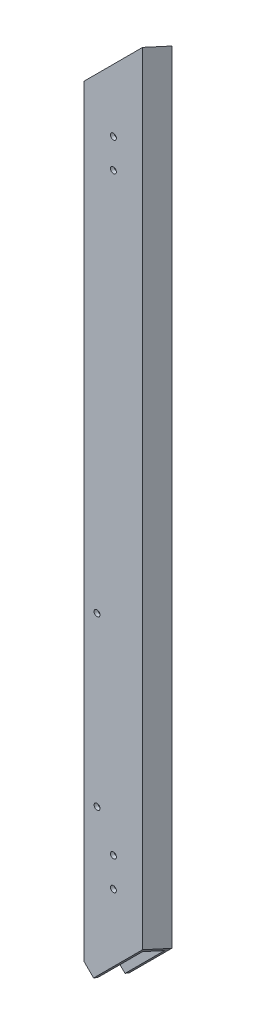
from build123d import *

# Parameters (mm, degrees)
SKETCH1_W                        = 50.8
SKETCH1_H                        = 25.4
SKETCH1_W_2                      = 44.45
SKETCH1_H_2                      = 19.05
BOSS_EXTRUDE1_DEPTH              = 728.3704
CUT_EXTRUDE1_DEPTH               = 730.255620202
CUT_EXTRUDE2_DEPTH               = 552.395616702
CUT_EXTRUDE3_DEPTH               = 735.841052167
F_13_64_0_20313_DIAMETER_HOLE1_D = 5.159502
F_13_64_0_20313_DIAMETER_HOLE2_D = 5.159502


with BuildPart() as part:
    # Sketch1 → Boss-Extrude1 (new body)
    with BuildSketch(Plane(origin=(0, 0, 0), x_dir=(1, 0, 0), z_dir=(0, 1, 0))):
        Rectangle(SKETCH1_W, SKETCH1_H)
        Rectangle(SKETCH1_W_2, SKETCH1_H_2, mode=Mode.SUBTRACT)
    extrude(amount=BOSS_EXTRUDE1_DEPTH)

    # Sketch2 → Cut-Extrude1 (cut, through all)
    with BuildSketch(Plane.XY.offset(12.7)):
        Polygon((-25.4, 677.5704), (25.4, 728.3704), (-25.4, 728.3704), align=None)
        Polygon((-11.4046, 0), (-25.4, 13.9954), (-25.4, 0), align=None)
        Polygon((-11.4046, 0), (25.4, 36.8046), (25.4, 0), align=None)
    extrude(amount=-CUT_EXTRUDE1_DEPTH, mode=Mode.SUBTRACT)

    # Sketch3 → Cut-Extrude2 (cut, through all)
    with BuildSketch(Plane(origin=(376.8852, 376.8852, 0), x_dir=(0, 0, -1), z_dir=(0.7071067811865417, 0.7071067811865535, 0))):
        Polygon((-12.7, 497.075136813), (12.7, 488.822176529), (12.7, 497.075136813), align=None)
    extrude(amount=-CUT_EXTRUDE2_DEPTH, mode=Mode.SUBTRACT)

    # Sketch4 → Cut-Extrude3 (cut, through all)
    with BuildSketch(Plane(origin=(-5.7023, -5.7023, 0), x_dir=(0, 0, 1), z_dir=(-0.7071067811865477, -0.7071067811865475, 0))):
        Polygon((-12.7, 8.064269997), (12.7, 16.317230281), (12.7, 8.064269997), align=None)
    extrude(amount=-CUT_EXTRUDE3_DEPTH, mode=Mode.SUBTRACT)

    # 13/64 (0.20313) Diameter Hole1 (through all)
    with Locations(Plane(origin=(0, 0, -12.7), x_dir=(-1, 0, 0), z_dir=(0, 0, -1))):
        with Locations((0, 623.07659026), (0, 648.47659026), (14.2367, 282.194), (14.2367, 136.398)):
            Hole(F_13_64_0_20313_DIAMETER_HOLE1_D / 2)

    # 13/64 (0.20313) Diameter Hole2 (through all)
    with Locations(Plane.XY.offset(12.7)):
        with Locations((0, 106.89437358), (0, 81.49437358)):
            Hole(F_13_64_0_20313_DIAMETER_HOLE2_D / 2)


solid = part.part
